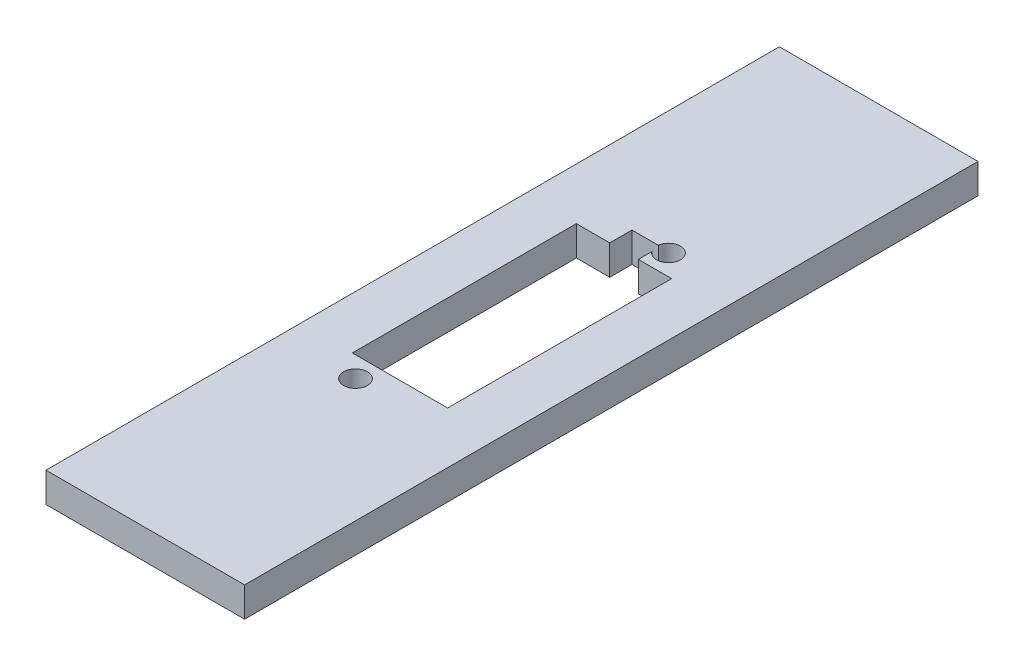
from build123d import *

# Parameters (mm, degrees)
SKETCH1_W           = 31.75
SKETCH1_H           = 117.2464
BOSS_EXTRUDE1_DEPTH = 4.7625
SKETCH3_W           = 15.24
SKETCH3_H           = 35.814
CUT_EXTRUDE1_DEPTH  = 4.7625
SKETCH4_R           = 1.905
CUT_EXTRUDE9_DEPTH  = 4.7625


with BuildPart() as part:
    # Sketch1 → Boss-Extrude1 (new body)
    with BuildSketch(Plane(origin=(0, 0, 0), x_dir=(1, 0, 0), z_dir=(0, 1, 0))):
        Rectangle(SKETCH1_W, SKETCH1_H)
    extrude(amount=BOSS_EXTRUDE1_DEPTH)

    # Sketch3 → Cut-Extrude1 (cut)
    with BuildSketch(Plane(origin=(0, 4.7625, 0), x_dir=(1, 0, 0), z_dir=(0, 1, 0))):
        Rectangle(SKETCH3_W, SKETCH3_H)
    extrude(amount=-CUT_EXTRUDE1_DEPTH, mode=Mode.SUBTRACT)

    # Sketch4 → Cut-Extrude9 (cut)
    with BuildSketch(Plane(origin=(0, 4.7625, 0), x_dir=(1, 0, 0), z_dir=(0, 1, 0))):
        with Locations(Location((-3.81, -21.209, 0), (0, 0, 270))):
            Circle(SKETCH4_R)
        with BuildLine():
            Line((-2.286, 21.463), (-2.286, 17.907))
            Line((-2.286, 17.907), (2.286, 17.907))
            Line((2.286, 17.907), (2.286, 20.066))
            ThreePointArc((2.286, 20.066), (1.966546058, 20.728684934), (1.922009269, 21.463))
            Line((1.922009269, 21.463), (-2.286, 21.463))
        make_face()
        with BuildLine():
            ThreePointArc((1.922009269, 21.463), (1.966546058, 20.728684934), (2.286, 20.066))
            Line((2.286, 20.066), (2.286, 21.463))
            Line((2.286, 21.463), (1.922009269, 21.463))
        make_face()
        with BuildLine():
            Line((2.286, 21.463), (2.286, 20.066))
            ThreePointArc((2.286, 20.066), (4.412413894, 19.401758317), (5.715, 21.209))
            ThreePointArc((5.715, 21.209), (3.937284441, 23.109742926), (1.922009269, 21.463))
            Line((1.922009269, 21.463), (2.286, 21.463))
        make_face()
    extrude(amount=-CUT_EXTRUDE9_DEPTH, mode=Mode.SUBTRACT)


solid = part.part
